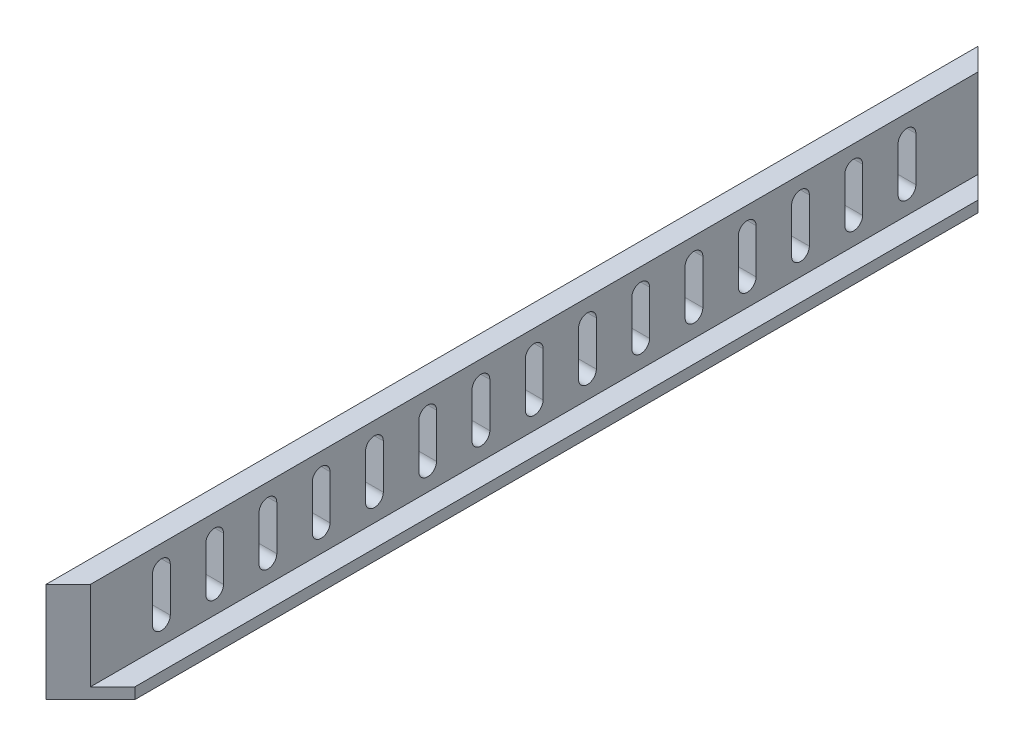
from build123d import *

# Parameters (mm, degrees)
BOSS_EXTRU_1_DEPTH             = 300
ENL_V_MAT_EXTRU_1_DEPTH        = 304.521004216
ENL_V_MAT_EXTRU_2_DEPTH        = 215.00934559
R_P_TITION_LIN_AIRE1_COUNT     = 8
R_P_TITION_LIN_AIRE1_PITCH     = 24
R_P_TITION_LIN_AIRE1_COL_COUNT = 8
R_P_TITION_LIN_AIRE1_COL_PITCH = 24


with BuildPart() as part:
    # Esquisse1 → Boss.-Extru.1 (new, symmetric)
    with BuildSketch(Plane.XY):
        Polygon((-10, 40), (-10, -5), (10, -5), (10, 0), (0, 0), (0, 40), align=None)
    extrude(amount=BOSS_EXTRU_1_DEPTH, both=True)

    # Esquisse2 → Enlèv. mat.-Extru.1 (cut, symmetric)
    with BuildSketch(Plane.XZ.offset(5)):
        Polygon((10, 190), (-10, 210), (-10, 300), (10, 300), align=None)
    enl_v_mat_extru_1 = extrude(amount=ENL_V_MAT_EXTRU_1_DEPTH, both=True, mode=Mode.SUBTRACT)

    # Symétrie1: Enlèv. mat.-Extru.1 across plane
    add(enl_v_mat_extru_1.mirror(Plane.XY), mode=Mode.SUBTRACT)

    # Esquisse3 → Enlèv. mat.-Extru.2 (cut, symmetric)
    with BuildSketch(Plane(origin=(0, 0, 0), x_dir=(0, 0, -1), z_dir=(1, 0, 0))):
        with BuildLine():
            Line((-4, 10), (-4, 30))
            ThreePointArc((-4, 30), (0, 34), (4, 30))
            Line((4, 30), (4, 10))
            ThreePointArc((4, 10), (0, 6), (-4, 10))
        make_face()
    enl_v_mat_extru_2 = extrude(amount=ENL_V_MAT_EXTRU_2_DEPTH, both=True, mode=Mode.SUBTRACT)

    # Répétition linéaire1: Enlèv. mat.-Extru.2 ×8
    with Locations(*[(0, 0, i * R_P_TITION_LIN_AIRE1_PITCH) for i in range(1, R_P_TITION_LIN_AIRE1_COUNT)]):
        add(enl_v_mat_extru_2, mode=Mode.SUBTRACT)

    # Répétition linéaire1 col: Enlèv. mat.-Extru.2 ×8
    with Locations(*[(0, 0, -i * R_P_TITION_LIN_AIRE1_COL_PITCH) for i in range(1, R_P_TITION_LIN_AIRE1_COL_COUNT)]):
        add(enl_v_mat_extru_2, mode=Mode.SUBTRACT)


solid = part.part
